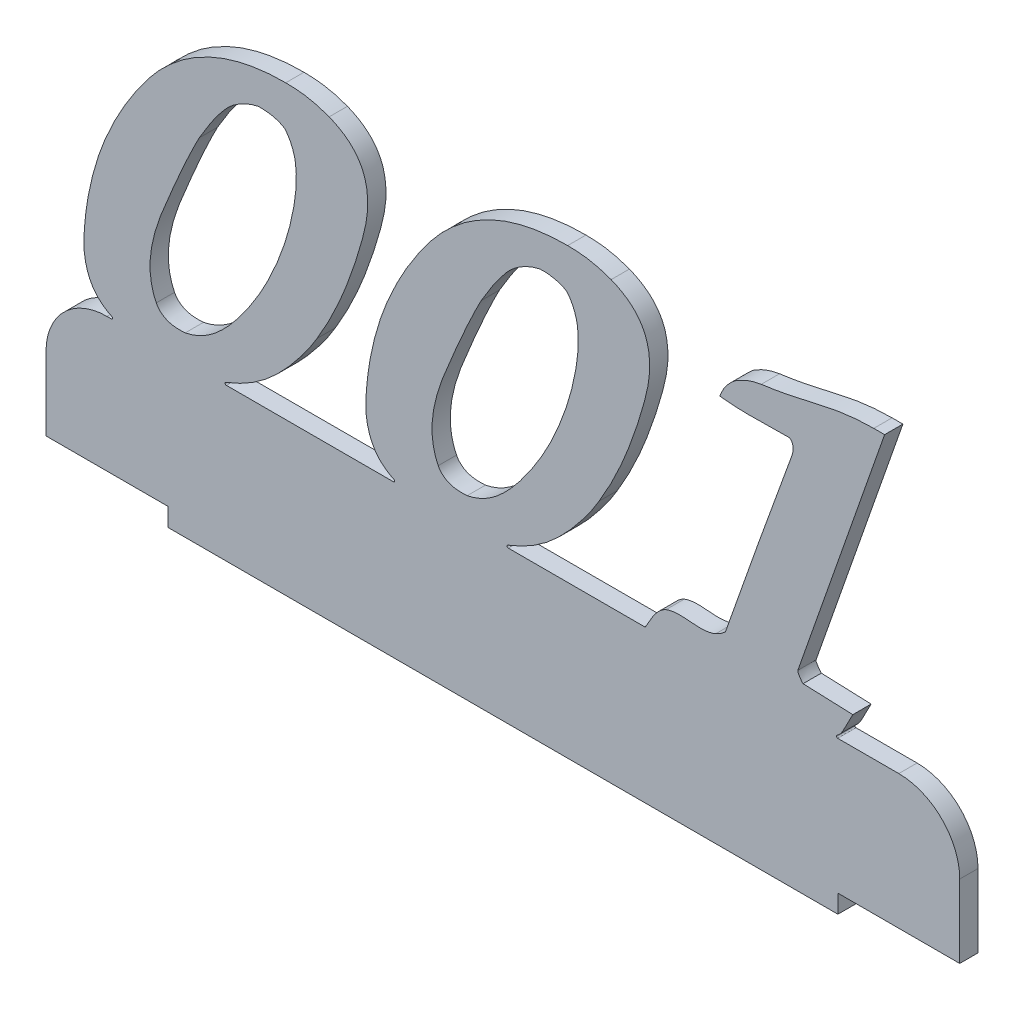
from build123d import *

# Parameters (mm, degrees)
BOSS_EXTRUDE1_DEPTH = 3
FILLET1_R           = 10
FILLET2_R           = 0.2


with BuildPart() as part:
    # Sketch1 → Boss-Extrude1 (new body)
    with BuildSketch(Plane.XY):
        with BuildLine():
            Line((139.349953687, 22.000000978), (150, 22.0000016))
            Line((150, 22.0000016), (150, 0))
            Line((150, 0), (130, 0))
            Line((130, 0), (130, -3))
            Line((130, -3), (20, -3))
            Line((20, -3), (20, 0))
            Line((20, 0), (0, 0))
            Line((0, 0), (0, 22.000000978))
            Line((0, 22.000000978), (11.860294587, 22.000000978))
            add(Edge.make_bspline(
                [(11.860294587, 22.000000978), (11.409062424, 22.14595174), (10.484277771, 22.488481885), (9.238333521, 23.299020649), (8.128370525, 24.318081191), (7.298497118, 25.595352038), (6.693014865, 27.066882239), (6.139390458, 29.431724421), (6.209022688, 31.351430996), (6.299364955, 32.665964261)],
                knots=[0.509396554, 0.509396554, 0.509396554, 0.509396554, 0.562299825, 0.61931963, 0.674487907, 0.729675441, 0.788153341, 0.851799168, 1, 1, 1, 1], degree=3))
            add(Edge.make_bspline(
                [(6.299364955, 32.665964261), (6.466289021, 34.894060669), (6.955481891, 38.219634295), (8.084868364, 42.556438413), (9.147700759, 45.765801795), (10.502324202, 48.899139312), (12.040322426, 52.004968537), (13.848058955, 55.048117478), (15.855144031, 58.015251501), (18.052682468, 60.804600197), (20.526937274, 63.223413998), (23.169201707, 65.311045685), (26.049421962, 66.958436479), (29.084921958, 68.306278169), (33.507329635, 69.528606905), (36.986048491, 69.913321184), (39.352531492, 69.882539711)],
                knots=[0, 0, 0, 0, 0.122246067, 0.183381441, 0.245050885, 0.307031795, 0.37001055, 0.434578783, 0.500534692, 0.565957523, 0.628479512, 0.689453544, 0.749684058, 0.80955899, 0.870724503, 1, 1, 1, 1], degree=3))
            add(Edge.make_bspline(
                [(39.352531492, 69.882539711), (40.612770947, 69.872089857), (43.055610228, 69.728573926), (45.395764152, 69.018718131), (46.487011554, 68.612015864)],
                knots=[0, 0, 0, 0, 0.519885394, 1, 1, 1, 1], degree=3))
            add(Edge.make_bspline(
                [(46.487011554, 68.612015864), (47.754558968, 68.096717652), (49.549611626, 67.103367681), (51.288924292, 65.120455661), (52.198446385, 63.446981541), (52.713728966, 61.542062727), (52.879039941, 59.425017365), (52.685932504, 57.094248821), (51.936532238, 53.754841278), (50.658011892, 49.588413193), (48.356828281, 43.284833679), (46.159912098, 38.858556288), (44.493266441, 36.106151908)],
                knots=[0, 0, 0, 0, 0.111905612, 0.162582178, 0.212592743, 0.265416324, 0.321765959, 0.384451445, 0.45478123, 0.599580751, 0.738515281, 1, 1, 1, 1], degree=3))
            add(Edge.make_bspline(
                [(44.493266441, 36.106151908), (43.401782322, 34.248939625), (41.531484889, 31.678465138), (38.78213351, 28.555482029), (36.613438613, 26.486214195), (34.231006935, 24.678551741), (31.551283139, 23.18275762), (29.577547095, 22.380417202), (28.520212965, 22.017268573), (28.469504318, 22.000000978)],
                knots=[0, 0, 0, 0, 0.257859597, 0.380113614, 0.498337489, 0.61657684, 0.737567111, 0.865047578, 0.871463301, 0.871463301, 0.871463301, 0.871463301], degree=3))
            Line((28.469504318, 22.000000978), (58.146455657, 22.000000978))
            add(Edge.make_bspline(
                [(58.146455657, 22.000000978), (57.695223492, 22.14595174), (56.770438837, 22.488481883), (55.524494584, 23.299020649), (54.414531588, 24.318081191), (53.584658181, 25.595352038), (52.979175928, 27.066882239), (52.425551521, 29.431724421), (52.495183752, 31.351430996), (52.585526019, 32.665964261)],
                knots=[0.509396554, 0.509396554, 0.509396554, 0.509396554, 0.562299825, 0.61931963, 0.674487907, 0.729675441, 0.788153341, 0.851799168, 1, 1, 1, 1], degree=3))
            add(Edge.make_bspline(
                [(52.585526019, 32.665964261), (52.752450085, 34.894060669), (53.241642955, 38.219634295), (54.371029428, 42.556438413), (55.433861822, 45.765801795), (56.788485265, 48.899139312), (58.32648349, 52.004968537), (60.134220019, 55.048117478), (62.141305095, 58.015251501), (64.338843531, 60.804600197), (66.813098337, 63.223413998), (69.455362771, 65.311045685), (72.335583025, 66.958436479), (75.371083021, 68.306278169), (79.793490698, 69.528606905), (83.272209554, 69.913321184), (85.638692555, 69.882539711)],
                knots=[0, 0, 0, 0, 0.122246067, 0.183381441, 0.245050885, 0.307031795, 0.37001055, 0.434578783, 0.500534692, 0.565957523, 0.628479512, 0.689453544, 0.749684058, 0.80955899, 0.870724503, 1, 1, 1, 1], degree=3))
            add(Edge.make_bspline(
                [(85.638692555, 69.882539711), (86.89893201, 69.872089857), (89.341771292, 69.728573926), (91.681925215, 69.018718131), (92.773172618, 68.612015864)],
                knots=[0, 0, 0, 0, 0.519885394, 1, 1, 1, 1], degree=3))
            add(Edge.make_bspline(
                [(92.773172618, 68.612015864), (94.040720031, 68.096717652), (95.835772689, 67.103367681), (97.575085355, 65.120455661), (98.484607448, 63.446981541), (98.99989003, 61.542062727), (99.165201004, 59.425017365), (98.972093567, 57.094248821), (98.222693301, 53.754841278), (96.944172955, 49.588413193), (94.642989344, 43.284833679), (92.446073162, 38.858556288), (90.779427504, 36.106151908)],
                knots=[0, 0, 0, 0, 0.111905612, 0.162582178, 0.212592743, 0.265416324, 0.321765959, 0.384451445, 0.45478123, 0.599580751, 0.738515281, 1, 1, 1, 1], degree=3))
            add(Edge.make_bspline(
                [(90.779427504, 36.106151908), (89.687943386, 34.248939625), (87.817645953, 31.678465138), (85.068294573, 28.555482029), (82.899599676, 26.486214195), (80.517167999, 24.678551741), (77.837444202, 23.18275762), (75.863708158, 22.380417202), (74.806374028, 22.017268573), (74.755665381, 22.000000978)],
                knots=[0, 0, 0, 0, 0.257859597, 0.380113614, 0.498337489, 0.61657684, 0.737567111, 0.865047578, 0.871463301, 0.871463301, 0.871463301, 0.871463301], degree=3))
            Line((74.755665381, 22.000000978), (98.366095368, 22.000000978))
            add(Edge.make_bspline(
                [(98.366095368, 22.000000978), (98.542774034, 22.280042489), (98.957598473, 22.998392051), (99.848724487, 24.596977572), (100.843343822, 25.766588383), (101.784118669, 26.196065903)],
                knots=[0.083264155, 0.083264155, 0.083264155, 0.083264155, 0.24891213, 0.498932816, 1, 1, 1, 1], degree=3))
            add(Edge.make_bspline(
                [(101.784118669, 26.196065903), (103.125486963, 26.715329914), (105.876224727, 26.440561854), (108.645558151, 26.284913754), (109.95456433, 26.860647608)],
                knots=[0, 0, 0, 0, 0.501451854, 1, 1, 1, 1], degree=3))
            add(Edge.make_bspline(
                [(109.95456433, 26.860647608), (110.836107267, 27.251160161), (111.537832508, 27.916159727)],
                knots=[0, 0, 0, 1, 1, 1], degree=2))
            add(Edge.make_bspline(
                [(111.537832508, 27.916159727), (113.320128387, 32.951332727), (116.845125589, 43.074133982), (120.534153582, 53.138330733), (122.366604987, 58.193720321)],
                knots=[0, 0, 0, 0, 0.498322561, 1, 1, 1, 1], degree=3))
            add(Edge.make_bspline(
                [(122.366604987, 58.193720321), (122.549782052, 58.691258534), (122.84496818, 59.657834307), (122.392374408, 60.56922978), (122.034314134, 60.773861056)],
                knots=[0, 0, 0, 0, 0.581397084, 1, 1, 1, 1], degree=3))
            add(Edge.make_bspline(
                [(122.034314134, 60.773861056), (120.117593252, 60.807658128), (116.312602372, 60.623749724), (112.499620653, 60.728486602), (110.619146034, 60.969326263)],
                knots=[0, 0, 0, 0, 0.503014916, 1, 1, 1, 1], degree=3))
            add(Edge.make_bspline(
                [(110.619146034, 60.969326263), (110.851108544, 61.636498758), (111.335352154, 62.585452793), (112.253346269, 63.646188965), (113.026630011, 64.368714001), (113.974591703, 64.922422592), (115.401609714, 65.605122214), (116.593667394, 65.919939088), (117.421335245, 66.05142165)],
                knots=[0, 0, 0, 0, 0.237267367, 0.352023708, 0.469658656, 0.590380818, 0.718477308, 1, 1, 1, 1], degree=3))
            add(Edge.make_bspline(
                [(117.421335245, 66.05142165), (120.53360127, 66.449858793), (124.395368864, 67.301862751), (129.017168418, 68.381676956), (132.097069513, 68.864152701), (134.390160806, 69.01170314), (135.892797324, 69.022492799)],
                knots=[0, 0, 0, 0, 0.501477793, 0.632810111, 0.759518477, 1, 1, 1, 1], degree=3))
            add(Edge.make_bspline(
                [(135.892797324, 69.022492799), (136.101293545, 69.022492799), (136.694204674, 69.022492799), (137.287115802, 69.022492799), (137.67153071, 69.022492799)],
                knots=[0, 0, 0, 0, 0.351648352, 1, 1, 1, 1], degree=3))
            Line((137.67153071, 69.022492799), (123.422117105, 28.385276224))
            add(Edge.make_bspline(
                [(123.422117105, 28.385276224), (123.368934451, 28.185479729), (123.700574186, 27.67578667), (123.978264534, 27.193003795), (124.282164017, 26.91928717)],
                knots=[0, 0, 0, 0, 0.324502414, 1, 1, 1, 1], degree=3))
            Line((124.282164017, 26.91928717), (132.452609678, 26.606542838))
            add(Edge.make_bspline(
                [(132.452609678, 26.606542838), (131.857670113, 25.593323712), (131.312510004, 24.271084335), (130.41453372, 22.804888239), (129.842039, 22.332866434), (129.443173012, 22.091092047), (129.268624226, 22.000000978)],
                knots=[0, 0, 0, 0, 0.504343167, 0.619768133, 0.735364226, 0.820322841, 0.820322841, 0.820322841, 0.820322841], degree=3))
            Line((129.268624226, 22.000000978), (139.349953687, 22.000000978))
        make_face()
        with BuildLine():
            add(Edge.make_bspline(
                [(39.215705847, 63.275815708), (38.61444588, 63.685332858), (37.149157574, 64.191477053), (35.611361534, 64.318772189), (34.798192164, 64.272688265)],
                knots=[0, 0, 0, 0, 0.469698931, 1, 1, 1, 1], degree=3))
            add(Edge.make_bspline(
                [(34.798192164, 64.272688265), (33.653490892, 64.031999762), (32.035451984, 63.354471457), (30.14706504, 61.976905708), (27.839158363, 59.398845433), (26.305460599, 56.947261385), (25.161757449, 54.968544402)],
                knots=[0, 0, 0, 0, 0.252589616, 0.375811021, 0.503770371, 1, 1, 1, 1], degree=3))
            add(Edge.make_bspline(
                [(25.161757449, 54.968544402), (24.705478634, 54.170488648), (24.10725882, 52.853923022), (23.215745658, 51.034860663), (22.502277997, 49.453312713), (21.737896473, 47.734084229), (20.93740917, 45.867355385), (20.080810371, 43.871147284), (19.208746353, 41.782825575), (18.415757861, 39.684649581), (17.784102154, 37.657296395), (17.343296614, 35.75020269), (17.100395129, 33.957158847), (17.0530813, 32.277874317), (17.254785472, 30.25217511), (17.674293478, 28.828517759), (18.10546347, 27.974799289)],
                knots=[0, 0, 0, 0, 0.095871325, 0.150956838, 0.211549603, 0.277044413, 0.347448488, 0.423659813, 0.503898773, 0.583776288, 0.6578152, 0.725493304, 0.78794858, 0.846481479, 0.900510454, 1, 1, 1, 1], degree=3))
            add(Edge.make_bspline(
                [(18.10546347, 27.974799289), (18.463910311, 27.231782271), (19.963384367, 26.024506789), (21.876285414, 26.007918537), (22.855268005, 26.078786779)],
                knots=[0, 0, 0, 0, 0.446153942, 1, 1, 1, 1], degree=3))
            add(Edge.make_bspline(
                [(22.855268005, 26.078786779), (24.312792503, 26.353141987), (26.469387771, 27.371562553), (29.001689288, 29.539332085), (30.952151238, 31.696524663), (32.818950277, 34.182043834), (34.580476043, 36.856045631), (36.17092418, 39.682532229), (37.565452099, 42.638780229), (38.763602267, 45.655764689), (39.755137247, 48.667826538), (40.473819136, 51.656323392), (40.978356344, 54.54692674), (41.147973164, 57.248681996), (40.94610703, 60.279245161), (40.071260418, 62.267796625), (39.215705847, 63.275815708)],
                knots=[0, 0, 0, 0, 0.099522769, 0.157975555, 0.224341199, 0.295661745, 0.367825167, 0.440561069, 0.514605516, 0.588508481, 0.659789613, 0.728660389, 0.796041852, 0.857776262, 0.9112652, 1, 1, 1, 1], degree=3))
        make_face(mode=Mode.SUBTRACT)
        with BuildLine():
            add(Edge.make_bspline(
                [(85.50186691, 63.275815708), (84.900606944, 63.685332858), (83.435318638, 64.191477053), (81.897522598, 64.318772189), (81.084353227, 64.272688265)],
                knots=[0, 0, 0, 0, 0.469698931, 1, 1, 1, 1], degree=3))
            add(Edge.make_bspline(
                [(81.084353227, 64.272688265), (79.939651955, 64.031999762), (78.321613048, 63.354471457), (76.433226104, 61.976905708), (74.125319426, 59.398845433), (72.591621662, 56.947261385), (71.447918513, 54.968544402)],
                knots=[0, 0, 0, 0, 0.252589616, 0.375811021, 0.503770371, 1, 1, 1, 1], degree=3))
            add(Edge.make_bspline(
                [(71.447918513, 54.968544402), (70.991639697, 54.170488648), (70.393419883, 52.853923022), (69.501906722, 51.034860663), (68.788439061, 49.453312713), (68.024057537, 47.734084229), (67.223570233, 45.867355385), (66.366971434, 43.871147284), (65.494907417, 41.782825575), (64.701918925, 39.684649581), (64.070263217, 37.657296395), (63.629457677, 35.75020269), (63.386556192, 33.957158847), (63.339242364, 32.277874317), (63.540946535, 30.25217511), (63.960454541, 28.828517759), (64.391624533, 27.974799289)],
                knots=[0, 0, 0, 0, 0.095871325, 0.150956838, 0.211549603, 0.277044413, 0.347448488, 0.423659813, 0.503898773, 0.583776288, 0.6578152, 0.725493304, 0.78794858, 0.846481479, 0.900510454, 1, 1, 1, 1], degree=3))
            add(Edge.make_bspline(
                [(64.391624533, 27.974799289), (64.750071374, 27.231782271), (66.24954543, 26.024506789), (68.162446477, 26.007918537), (69.141429068, 26.078786779)],
                knots=[0, 0, 0, 0, 0.446153942, 1, 1, 1, 1], degree=3))
            add(Edge.make_bspline(
                [(69.141429068, 26.078786779), (70.598953566, 26.353141987), (72.755548834, 27.371562553), (75.287850351, 29.539332085), (77.238312301, 31.696524663), (79.10511134, 34.182043834), (80.866637106, 36.856045631), (82.457085244, 39.682532229), (83.851613163, 42.638780229), (85.049763331, 45.655764689), (86.04129831, 48.667826538), (86.759980199, 51.656323392), (87.264517408, 54.54692674), (87.434134227, 57.248681996), (87.232268093, 60.279245161), (86.357421481, 62.267796625), (85.50186691, 63.275815708)],
                knots=[0, 0, 0, 0, 0.099522769, 0.157975555, 0.224341199, 0.295661745, 0.367825167, 0.440561069, 0.514605516, 0.588508481, 0.659789613, 0.728660389, 0.796041852, 0.857776262, 0.9112652, 1, 1, 1, 1], degree=3))
        make_face(mode=Mode.SUBTRACT)
    extrude(amount=BOSS_EXTRUDE1_DEPTH)

    # Fillet1
    fillet1_edges = [part.edges().sort_by_distance(p)[0] for p in [
        (150, 22.0000016, 1.5),
        (0, 22.000000978, 1.5),
    ]]
    fillet(fillet1_edges, radius=FILLET1_R)

    # Fillet2
    fillet2_edges = [part.edges().sort_by_distance(p)[0] for p in [
        (11.860294587, 22.000000978, 1.5),
        (58.146455657, 22.000000978, 1.5),
        (98.366095368, 22.000000978, 1.5),
        (129.268624226, 22.000000978, 1.5),
        (74.755665381, 22.000000978, 1.5),
        (28.469504318, 22.000000978, 1.5),
    ]]
    fillet(fillet2_edges, radius=FILLET2_R)


solid = part.part
